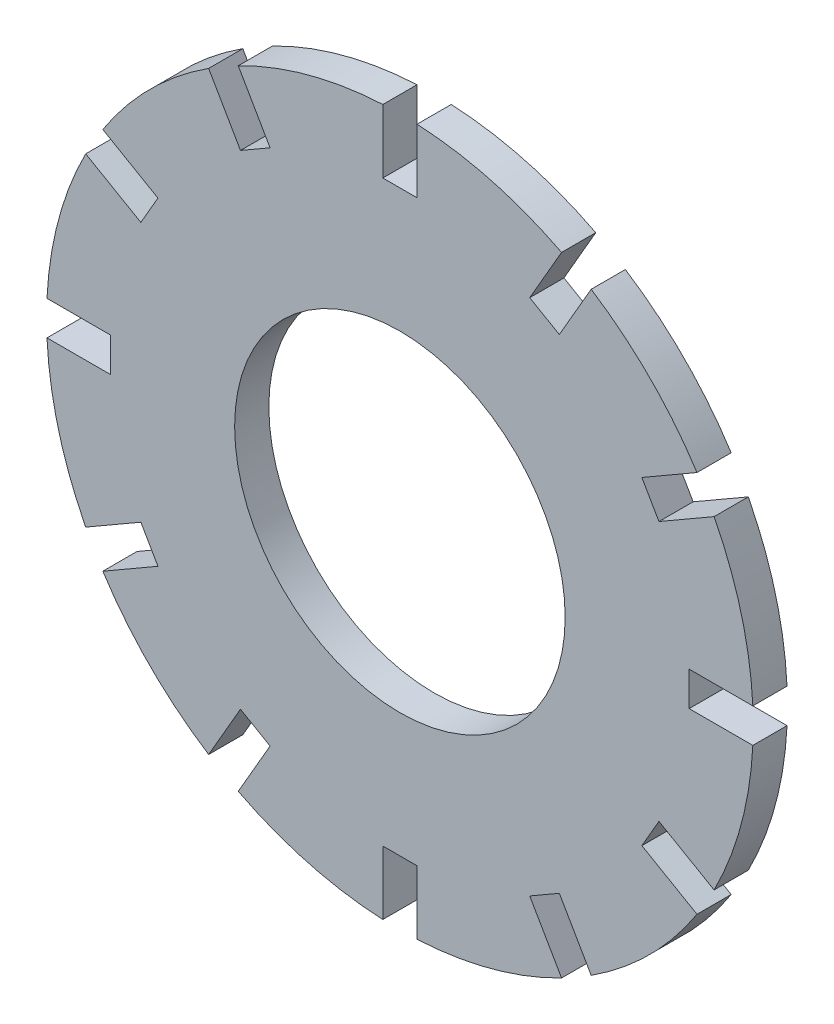
from build123d import *

# Parameters (mm, degrees)
MODEL_R                 = 14.5
SALIENTE_EXTRUIR1_DEPTH = 3


with BuildPart() as part:
    # Model → Saliente-Extruir1 (new body)
    with BuildSketch(Plane.XY):
        with BuildLine():
            Line((47.37313945, 289.774034505), (50.166269539, 294.611877731))
            ThreePointArc((50.166269539, 294.611877731), (44.006853837, 296.990237588), (37.483463439, 298.010225383))
            Line((37.483463439, 298.010225383), (37.483463439, 292.423965206))
            Line((37.483463439, 292.423965206), (34.483463439, 292.423965206))
            Line((34.483463439, 292.423965206), (34.483463439, 298.010225383))
            ThreePointArc((34.483463439, 298.010225383), (27.960073041, 296.990237588), (21.800657339, 294.611877731))
            Line((21.800657339, 294.611877731), (24.593787428, 289.774034505))
            Line((24.593787428, 289.774034505), (21.995711217, 288.274034505))
            Line((21.995711217, 288.274034505), (19.202581128, 293.111877731))
            ThreePointArc((19.202581128, 293.111877731), (14.063153222, 288.966847189), (9.91812268, 283.827419284))
            Line((9.91812268, 283.827419284), (14.755965907, 281.034289195))
            Line((14.755965907, 281.034289195), (13.255965907, 278.436212983))
            Line((13.255965907, 278.436212983), (8.41812268, 281.229343072))
            ThreePointArc((8.41812268, 281.229343072), (6.039762824, 275.069927371), (5.019775028, 268.546536973))
            Line((5.019775028, 268.546536973), (10.606035206, 268.546536973))
            Line((10.606035206, 268.546536973), (10.606035206, 265.546536973))
            Line((10.606035206, 265.546536973), (5.019775028, 265.546536973))
            ThreePointArc((5.019775028, 265.546536973), (6.039762824, 259.023146574), (8.41812268, 252.863730873))
            Line((8.41812268, 252.863730873), (13.255965907, 255.656860962))
            Line((13.255965907, 255.656860962), (14.755965907, 253.05878475))
            Line((14.755965907, 253.05878475), (9.91812268, 250.265654662))
            ThreePointArc((9.91812268, 250.265654662), (14.063153222, 245.126226756), (19.202581128, 240.981196214))
            Line((19.202581128, 240.981196214), (21.995711217, 245.81903944))
            Line((21.995711217, 245.81903944), (24.593787428, 244.31903944))
            Line((24.593787428, 244.31903944), (21.800657339, 239.481196214))
            ThreePointArc((21.800657339, 239.481196214), (27.960073041, 237.102836358), (34.483463439, 236.082848562))
            Line((34.483463439, 236.082848562), (34.483463439, 241.66910874))
            Line((34.483463439, 241.66910874), (37.483463439, 241.66910874))
            Line((37.483463439, 241.66910874), (37.483463439, 236.082848562))
            ThreePointArc((37.483463439, 236.082848562), (44.006853837, 237.102836358), (50.166269539, 239.481196214))
            Line((50.166269539, 239.481196214), (47.37313945, 244.31903944))
            Line((47.37313945, 244.31903944), (49.971215661, 245.81903944))
            Line((49.971215661, 245.81903944), (52.76434575, 240.981196214))
            ThreePointArc((52.76434575, 240.981196214), (57.903773656, 245.126226756), (62.048804198, 250.265654662))
            Line((62.048804198, 250.265654662), (57.210960972, 253.05878475))
            Line((57.210960972, 253.05878475), (58.710960972, 255.656860962))
            Line((58.710960972, 255.656860962), (63.548804198, 252.863730873))
            ThreePointArc((63.548804198, 252.863730873), (65.927164054, 259.023146574), (66.94715185, 265.546536973))
            Line((66.94715185, 265.546536973), (61.360891672, 265.546536973))
            Line((61.360891672, 265.546536973), (61.360891672, 268.546536973))
            Line((61.360891672, 268.546536973), (66.94715185, 268.546536973))
            ThreePointArc((66.94715185, 268.546536973), (65.927164054, 275.069927371), (63.548804198, 281.229343072))
            Line((63.548804198, 281.229343072), (58.710960972, 278.436212983))
            Line((58.710960972, 278.436212983), (57.210960972, 281.034289195))
            Line((57.210960972, 281.034289195), (62.048804198, 283.827419284))
            ThreePointArc((62.048804198, 283.827419284), (57.903773656, 288.966847189), (52.76434575, 293.111877731))
            Line((52.76434575, 293.111877731), (49.971215661, 288.274034505))
            Line((49.971215661, 288.274034505), (47.37313945, 289.774034505))
        make_face()
        with Locations((35.983463439, 267.046536973)):
            Circle(MODEL_R, mode=Mode.SUBTRACT)
    extrude(amount=SALIENTE_EXTRUIR1_DEPTH)


solid = part.part
